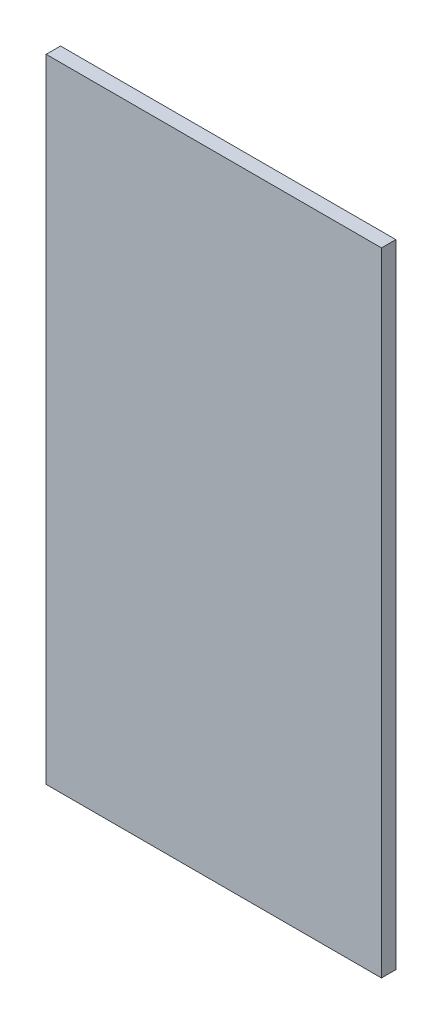
from build123d import *

# Parameters (mm, degrees)
SKETCH1_W           = 420
SKETCH1_H           = 792
BOSS_EXTRUDE1_DEPTH = 18


with BuildPart() as part:
    # Sketch1 → Boss-Extrude1 (new body)
    with BuildSketch(Plane.XY):
        with Locations((210, 396)):
            Rectangle(SKETCH1_W, SKETCH1_H)
    extrude(amount=BOSS_EXTRUDE1_DEPTH)


solid = part.part
